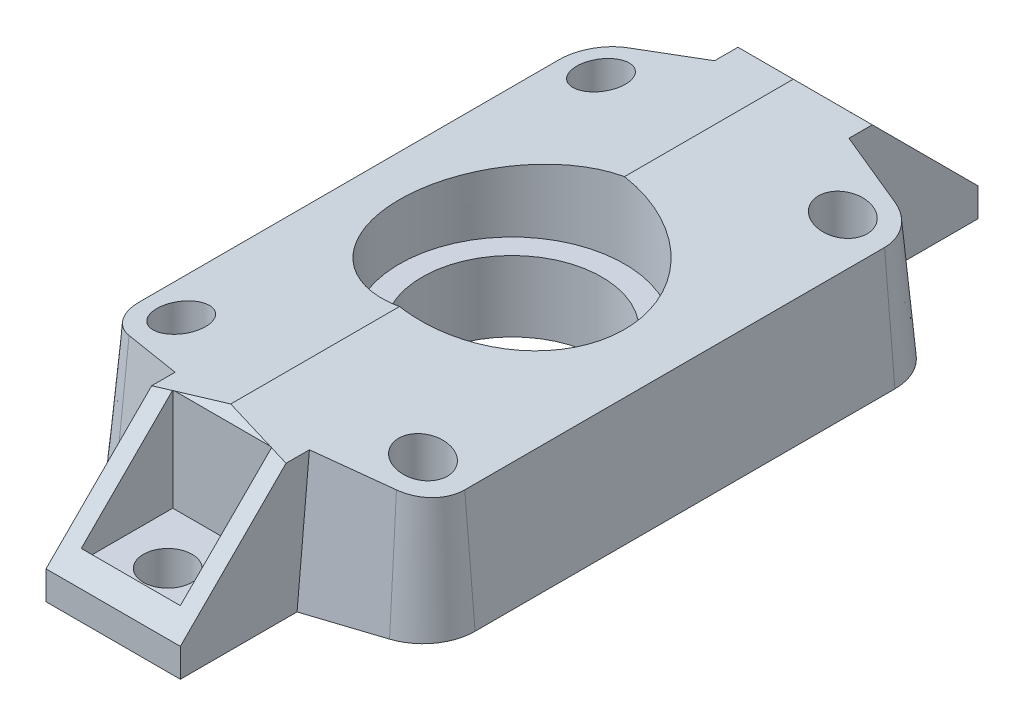
from build123d import *

# Parameters (mm, degrees)
SKETCH1_R               = 3.683
SKETCH1_W               = 14.986
SKETCH1_H               = 13.843
SKETCH1_R_2             = 17.018
BOSS_EXTRUDE2_DEPTH     = 22.098
DRAFT2_ANGLE            = -5
SKETCH1_4_W             = 14.986
SKETCH1_4_H             = 13.843
SKETCH1_4_R             = 3.683
BOSS_EXTRUDE3_DEPTH     = 5.334
CUT_EXTRUDE1_DEPTH      = 97.762405579
CUT_EXTRUDE1_DEPTH_BACK = 97.762405579
CUT_EXTRUDE2_DEPTH      = 97.762405579
CUT_EXTRUDE2_DEPTH_BACK = 97.762405579
SKETCH1_5_R             = 17.018
SKETCH1_5_R_2           = 13.589
BOSS_EXTRUDE4_DEPTH     = 10.668


with BuildPart() as part:
    # Sketch1 → Boss-Extrude2 (new body)
    with BuildSketch(Plane(origin=(0, 0, 0), x_dir=(1, 0, 0), z_dir=(0, 1, 0))):
        with BuildLine():
            Line((-30.231365501, 53.976983945), (-50.551365501, 53.976983945))
            Line((-50.551365501, 53.976983945), (-50.551365501, 36.322144789))
            Line((-50.551365501, 36.322144789), (-61.112565315, 32.890602954))
            ThreePointArc((-61.112565315, 32.890602954), (-65.049565315, 30.030205021), (-66.553365501, 25.401983945))
            Line((-66.553365501, 25.401983945), (-66.553365501, -38.098016055))
            ThreePointArc((-66.553365501, -38.098016055), (-65.049565315, -42.726237132), (-61.112565315, -45.586635064))
            Line((-61.112565315, -45.586635064), (-50.551365501, -49.0181769))
            Line((-50.551365501, -49.0181769), (-50.551365501, -66.673016055))
            Line((-50.551365501, -66.673016055), (-30.231365501, -66.673016055))
            Line((-30.231365501, -66.673016055), (-30.231365501, -49.0181769))
            Line((-30.231365501, -49.0181769), (-19.670165688, -45.586635064))
            ThreePointArc((-19.670165688, -45.586635064), (-15.733165688, -42.726237132), (-14.229365501, -38.098016055))
            Line((-14.229365501, -38.098016055), (-14.229365501, 25.401983945))
            ThreePointArc((-14.229365501, 25.401983945), (-15.733165688, 30.030205021), (-19.670165688, 32.890602954))
            Line((-19.670165688, 32.890602954), (-30.231365501, 36.322144789))
            Line((-30.231365501, 36.322144789), (-30.231365501, 53.976983945))
        make_face()
        with Locations((-58.679365501, -38.098016055)):
            Circle(SKETCH1_R, mode=Mode.SUBTRACT)
        with Locations((-40.391365501, -57.084516055)):
            Rectangle(SKETCH1_W, SKETCH1_H, mode=Mode.SUBTRACT)
        with Locations((-22.103365501, -38.098016055)):
            Circle(SKETCH1_R, mode=Mode.SUBTRACT)
        with Locations((-40.391365501, -6.348016055)):
            Circle(SKETCH1_R_2, mode=Mode.SUBTRACT)
        with Locations((-58.679365501, 25.401983945)):
            Circle(SKETCH1_R, mode=Mode.SUBTRACT)
        with Locations((-40.391365501, 44.388483945)):
            Rectangle(SKETCH1_W, SKETCH1_H, mode=Mode.SUBTRACT)
        with Locations((-22.103365501, 25.401983945)):
            Circle(SKETCH1_R, mode=Mode.SUBTRACT)
    extrude(amount=BOSS_EXTRUDE2_DEPTH)

    # Draft2
    draft2_faces = [part.faces().sort_by_distance(p)[0] for p in [
        (-55.831965408, 11.049, -34.606373872),
        (-65.049565315, 11.049, -30.030205021),
        (-66.553365501, 11.049, 6.348016055),
        (-65.049565315, 11.049, 42.726237132),
        (-55.831965408, 11.049, 47.302405982),
        (-15.733165688, 11.049, 42.726237132),
        (-24.950765594, 11.049, 47.302405982),
        (-24.950765594, 11.049, -34.606373872),
        (-15.733165688, 11.049, -30.030205021),
        (-14.229365501, 11.049, 6.348016055),
    ]]
    draft(draft2_faces, Plane(origin=(0, 0, 0), x_dir=(0, 0, -1), z_dir=(0, -1, 0)), DRAFT2_ANGLE)

    # Sketch1<4> → Boss-Extrude3 (add)
    # profile 1 of 2: a face of its own
    with BuildSketch(Plane(origin=(0, 0, 0), x_dir=(1, 0, 0), z_dir=(0, 1, 0))):
        with Locations((-40.391365501, 44.388483945)):
            Rectangle(SKETCH1_4_W, SKETCH1_4_H)
        with Locations((-40.391365501, 45.721983945)):
            Circle(SKETCH1_4_R, mode=Mode.SUBTRACT)
    # profile 2 of 2: a face of its own
    with BuildSketch(Plane(origin=(0, 0, 0), x_dir=(1, 0, 0), z_dir=(0, 1, 0))):
        with Locations((-40.391365501, -57.084516055)):
            Rectangle(SKETCH1_4_W, SKETCH1_4_H)
        with Locations((-40.391365501, -58.418016055)):
            Circle(SKETCH1_4_R, mode=Mode.SUBTRACT)
    extrude(amount=BOSS_EXTRUDE3_DEPTH)

    # Sketch2 → Cut-Extrude1 (cut, two sides: drawn at the far end of the back side and taken through both)
    with BuildSketch(Plane(origin=(0, 0, 0), x_dir=(0, 0, -1), z_dir=(1, 0, 0)).offset(-CUT_EXTRUDE1_DEPTH_BACK)):
        Polygon((-66.673016055, 4.318), (-66.673016055, 22.098), (-48.893016055, 22.098), align=None)
        Polygon((36.196983945, 22.098), (53.976983945, 22.098), (53.976983945, 4.318), align=None)
    extrude(amount=CUT_EXTRUDE1_DEPTH + CUT_EXTRUDE1_DEPTH_BACK, mode=Mode.SUBTRACT)

    # Sketch3 → Cut-Extrude2 (cut, two sides: drawn at the far end of the back side and taken through both)
    with BuildSketch(Plane.XY.offset(-CUT_EXTRUDE2_DEPTH_BACK)):
        Polygon((-16.162689988, 22.098), (-40.391365501, 22.098), (-15.783067323, 17.758893082), align=None)
        Polygon((-40.391365501, 22.098), (-64.620041015, 22.098), (-64.99966368, 17.758893082), align=None)
    extrude(amount=CUT_EXTRUDE2_DEPTH + CUT_EXTRUDE2_DEPTH_BACK, mode=Mode.SUBTRACT)

    # Sketch1<5> → Boss-Extrude4 (add)
    with BuildSketch(Plane(origin=(0, 0, 0), x_dir=(1, 0, 0), z_dir=(0, 1, 0))):
        with Locations((-40.391365501, -6.348016055)):
            Circle(SKETCH1_5_R)
        with Locations((-40.391365501, -6.348016055)):
            Circle(SKETCH1_5_R_2, mode=Mode.SUBTRACT)
    extrude(amount=BOSS_EXTRUDE4_DEPTH)


solid = part.part
